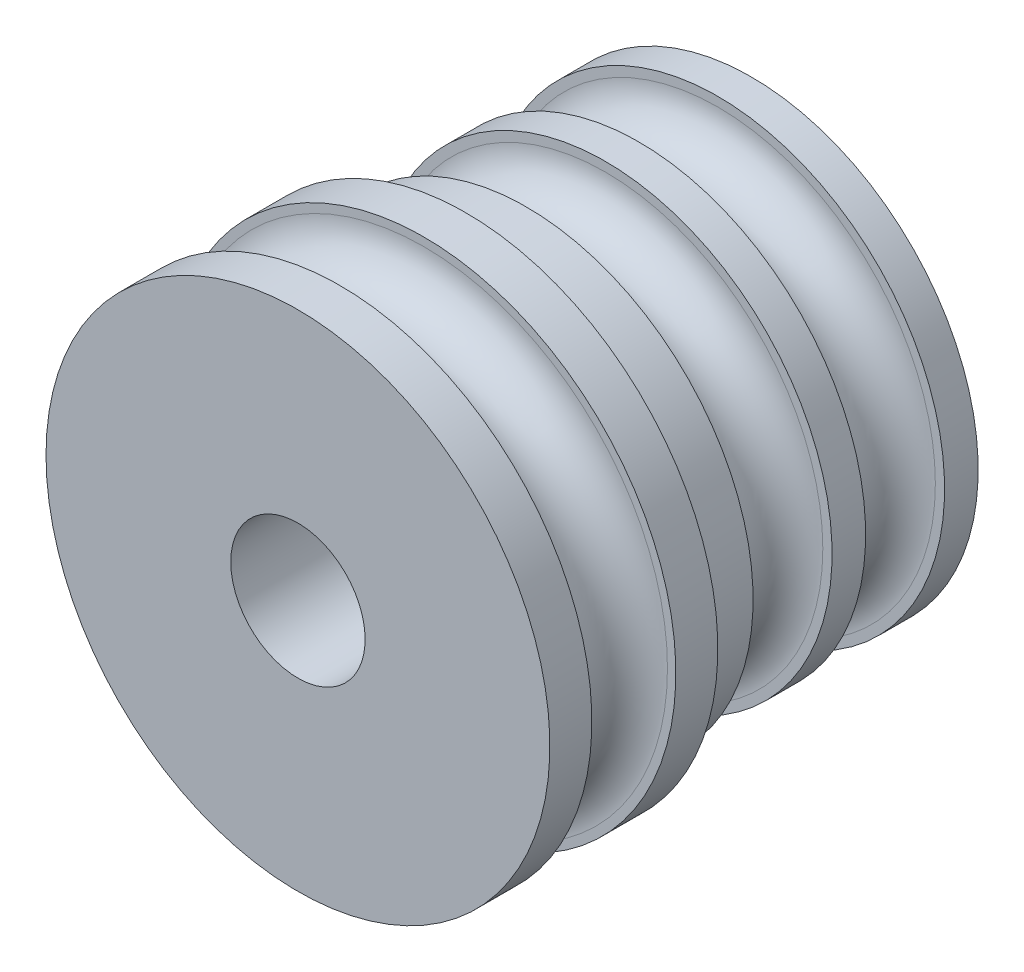
from build123d import *


with BuildPart() as part:
    # Sketch1 → Revolve1 (revolve)
    with BuildSketch(Plane(origin=(0, 0, 0), x_dir=(1, 0, 0), z_dir=(0, 1, 0)), mode=Mode.PRIVATE) as revolve1_sk:
        with BuildLine():
            Line((-52.556301458, 30.109678387), (-52.556301458, 3.109678387))
            Line((-52.556301458, 3.109678387), (-41.556301458, 3.109678387))
            Line((-41.556301458, 3.109678387), (-41.556301458, 5.609678387))
            Line((-41.556301458, 5.609678387), (-42.056301458, 5.609678387))
            ThreePointArc((-42.056301458, 5.609678387), (-44.556301458, 8.109678387), (-42.056301458, 10.609678387))
            Line((-42.056301458, 10.609678387), (-41.556301458, 10.609678387))
            Line((-41.556301458, 10.609678387), (-41.556301458, 13.109678387))
            Line((-41.556301458, 13.109678387), (-43.056301458, 13.109678387))
            Line((-43.056301458, 13.109678387), (-43.056301458, 16.709678387))
            Line((-43.056301458, 16.709678387), (-43.606301458, 16.709678387))
            ThreePointArc((-43.606301458, 16.709678387), (-45.956301458, 19.059678387), (-43.606301458, 21.409678387))
            Line((-43.606301458, 21.409678387), (-43.056301458, 21.409678387))
            Line((-43.056301458, 21.409678387), (-43.056301458, 23.409678387))
            Line((-43.056301458, 23.409678387), (-43.606301458, 23.409678387))
            ThreePointArc((-43.606301458, 23.409678387), (-45.956301458, 25.759678387), (-43.606301458, 28.109678387))
            Line((-43.606301458, 28.109678387), (-43.056301458, 28.109678387))
            Line((-43.056301458, 28.109678387), (-43.056301458, 30.109678387))
            Line((-43.056301458, 30.109678387), (-52.556301458, 30.109678387))
        make_face()
    revolve(revolve1_sk.sketch.rotate(Axis((-56.556301458, 0, -59.887711331), (0, 0, 1)), 180), axis=Axis((-56.556301458, 0, -59.887711331), (0, 0, 1)))


solid = part.part
